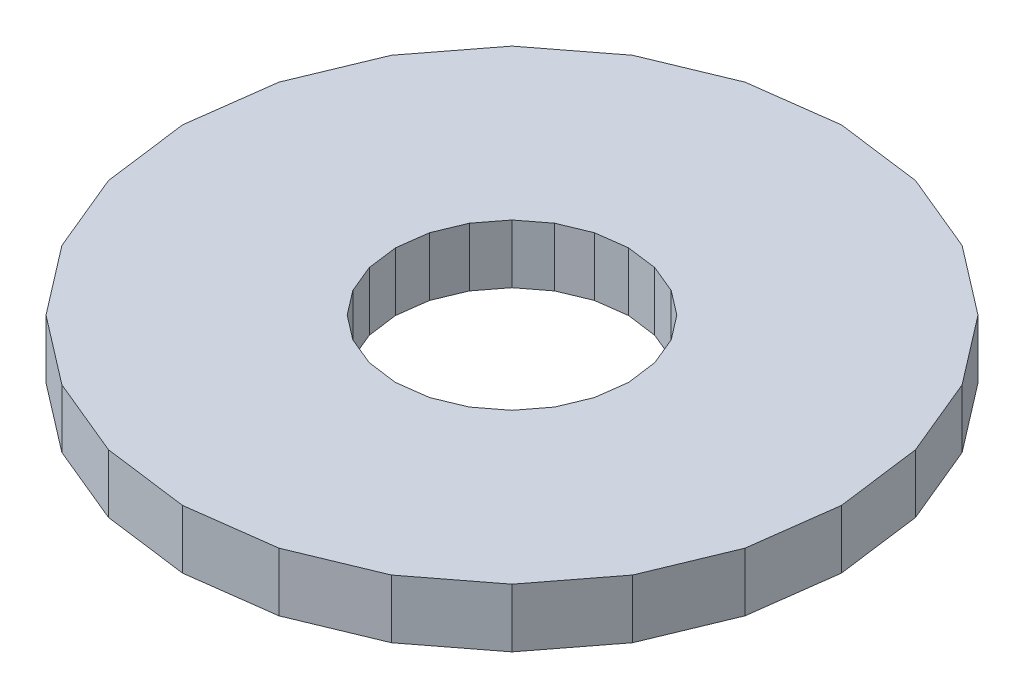
from build123d import *

# Parameters (mm, degrees)
BOSS_EXTRUDE3_DEPTH = 19.05


with BuildPart() as part:
    # Sketch3 → Boss-Extrude3 (new body)
    with BuildSketch(Plane(origin=(0, 0, 0), x_dir=(1, 0, 0), z_dir=(0, 1, 0))):
        Polygon((-107.02832713, 0), (-103.38142532, -27.700969427), (-92.689250219, -53.514163565), (-75.680455893, -75.680455893), (-53.514163565, -92.689250219), (-27.700969427, -103.38142532), (0, -107.02832713), (27.700969427, -103.38142532), (53.514163565, -92.689250219), (75.680455893, -75.680455893), (92.689250219, -53.514163565), (103.38142532, -27.700969427), (107.02832713, 0), (103.38142532, 27.700969427), (92.689250219, 53.514163565), (75.680455893, 75.680455893), (53.514163565, 92.689250219), (27.700969427, 103.38142532), (0, 107.02832713), (-27.700969427, 103.38142532), (-53.514163565, 92.689250219), (-75.680455893, 75.680455893), (-92.689250219, 53.514163565), (-103.38142532, 27.700969427), align=None)
        Polygon((-37.856553014, 0), (-36.56662225, -9.797996902), (-32.78473661, -18.928276507), (-26.768625348, -26.768625348), (-18.928276507, -32.78473661), (-9.797996902, -36.56662225), (0, -37.856553014), (9.797996902, -36.56662225), (18.928276507, -32.78473661), (26.768625348, -26.768625348), (32.78473661, -18.928276507), (36.56662225, -9.797996902), (37.856553014, 0), (36.56662225, 9.797996902), (32.78473661, 18.928276507), (26.768625348, 26.768625348), (18.928276507, 32.78473661), (9.797996902, 36.56662225), (0, 37.856553014), (-9.797996902, 36.56662225), (-18.928276507, 32.78473661), (-26.768625348, 26.768625348), (-32.78473661, 18.928276507), (-36.56662225, 9.797996902), align=None, mode=Mode.SUBTRACT)
    extrude(amount=BOSS_EXTRUDE3_DEPTH)


solid = part.part
